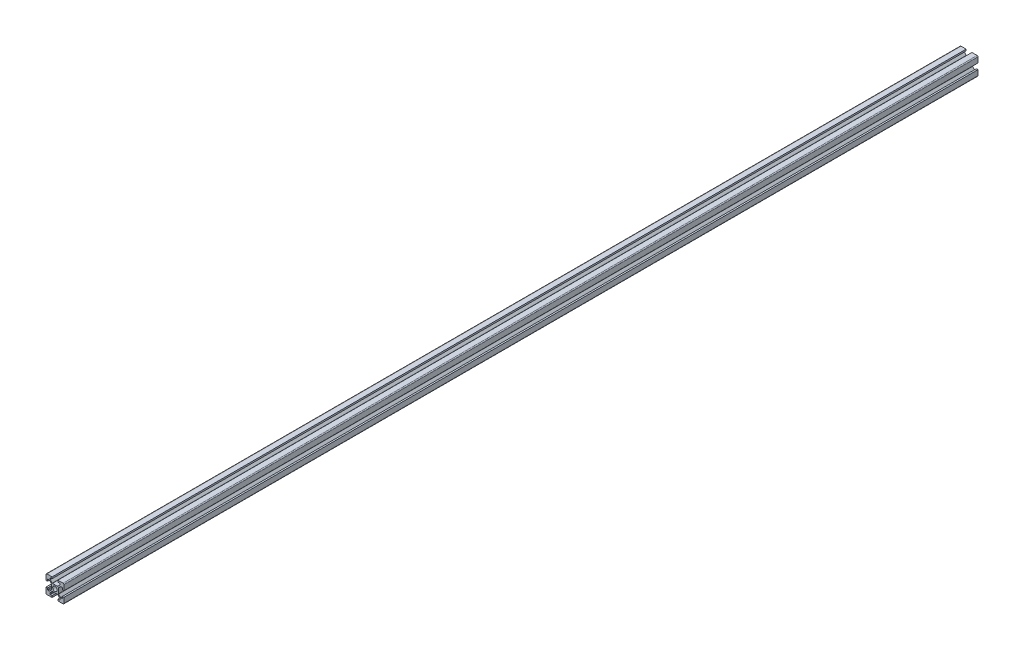
from build123d import *

# Parameters (mm, degrees)
SKETCH1_R           = 2.5
BOSS_EXTRUDE1_DEPTH = 1020
FILLET1_R           = 1
FILLET2_R           = 0.5
FILLET3_R           = 0.5
FILLET4_R           = 0.5
FILLET5_R           = 0.5


with BuildPart() as part:
    # Sketch1 → Boss-Extrude1 (new body)
    with BuildSketch(Plane.XY):
        Polygon((13.2, 0), (13.2, 1.8), (15.45, 1.8), (15.45, 3.6), (12.95, 6.1), (7.05, 6.1), (4.55, 3.6), (4.55, 1.8), (6.8, 1.8), (6.8, 0), (0, 0), (0, 6.8), (1.8, 6.8), (1.8, 4.55), (3.6, 4.55), (6.1, 7.05), (6.1, 12.95), (3.6, 15.45), (1.8, 15.45), (1.8, 13.2), (0, 13.2), (0, 20), (6.8, 20), (6.8, 18.2), (4.55, 18.2), (4.55, 16.4), (7.05, 13.9), (12.95, 13.9), (15.45, 16.4), (15.45, 18.2), (13.2, 18.2), (13.2, 20), (20, 20), (20, 13.2), (18.2, 13.2), (18.2, 15.45), (16.4, 15.45), (13.9, 12.95), (13.9, 7.05), (16.4, 4.55), (18.2, 4.55), (18.2, 6.8), (20, 6.8), (20, 0), align=None)
        with Locations((10, 10)):
            Circle(SKETCH1_R, mode=Mode.SUBTRACT)
    extrude(amount=BOSS_EXTRUDE1_DEPTH)

    # Fillet1
    fillet1_edges = [part.edges().sort_by_distance(p)[0] for p in [
        (0, 0, 510),
        (0, 20, 510),
        (20, 20, 510),
        (20, 0, 510),
    ]]
    fillet(fillet1_edges, radius=FILLET1_R)

    # Fillet2
    fillet2_edges = [part.edges().sort_by_distance(p)[0] for p in [
        (4.55, 18.2, 510),
        (4.55, 16.4, 510),
        (7.05, 13.9, 510),
        (12.95, 13.9, 510),
        (15.45, 16.4, 510),
        (15.45, 18.2, 510),
    ]]
    fillet(fillet2_edges, radius=FILLET2_R)

    # Fillet3
    fillet3_edges = [part.edges().sort_by_distance(p)[0] for p in [
        (18.2, 15.45, 510),
        (16.4, 15.45, 510),
        (13.9, 12.95, 510),
        (13.9, 7.05, 510),
        (16.4, 4.55, 510),
        (18.2, 4.55, 510),
    ]]
    fillet(fillet3_edges, radius=FILLET3_R)

    # Fillet4
    fillet4_edges = [part.edges().sort_by_distance(p)[0] for p in [
        (1.8, 4.55, 510),
        (3.6, 4.55, 510),
        (6.1, 7.05, 510),
        (6.1, 12.95, 510),
        (3.6, 15.45, 510),
        (1.8, 15.45, 510),
    ]]
    fillet(fillet4_edges, radius=FILLET4_R)

    # Fillet5
    fillet5_edges = [part.edges().sort_by_distance(p)[0] for p in [
        (15.45, 1.8, 510),
        (15.45, 3.6, 510),
        (12.95, 6.1, 510),
        (7.05, 6.1, 510),
        (4.55, 3.6, 510),
        (4.55, 1.8, 510),
    ]]
    fillet(fillet5_edges, radius=FILLET5_R)


solid = part.part
